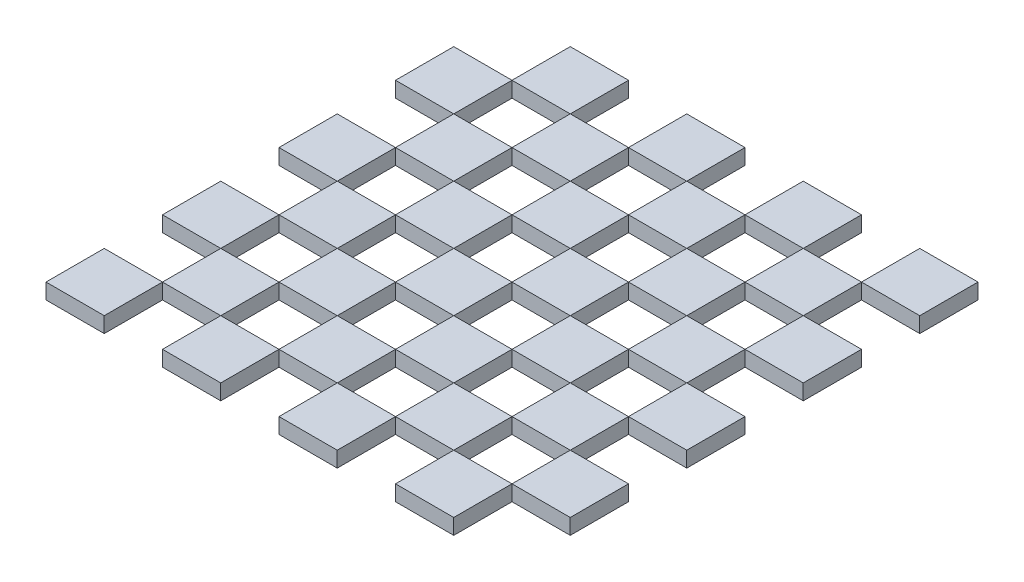
from build123d import *

# Parameters (mm, degrees)
SKETCH1_W              = 37.5
SKETCH1_H              = 37.5
BOSS_EXTRUDE1_DEPTH    = 10
BOSS_EXTRUDE1_2_DEPTH  = 10
BOSS_EXTRUDE1_3_DEPTH  = 10
BOSS_EXTRUDE1_4_DEPTH  = 10
BOSS_EXTRUDE1_5_DEPTH  = 10
BOSS_EXTRUDE1_6_DEPTH  = 10
BOSS_EXTRUDE1_7_DEPTH  = 10
BOSS_EXTRUDE1_8_DEPTH  = 10
BOSS_EXTRUDE1_9_DEPTH  = 10
BOSS_EXTRUDE1_10_DEPTH = 10
BOSS_EXTRUDE1_11_DEPTH = 10
BOSS_EXTRUDE1_12_DEPTH = 10
BOSS_EXTRUDE1_13_DEPTH = 10
BOSS_EXTRUDE1_14_DEPTH = 10
BOSS_EXTRUDE1_15_DEPTH = 10
BOSS_EXTRUDE1_16_DEPTH = 10
BOSS_EXTRUDE1_17_DEPTH = 10
BOSS_EXTRUDE1_18_DEPTH = 10
BOSS_EXTRUDE1_19_DEPTH = 10
BOSS_EXTRUDE1_20_DEPTH = 10
BOSS_EXTRUDE1_21_DEPTH = 10
BOSS_EXTRUDE1_22_DEPTH = 10
BOSS_EXTRUDE1_23_DEPTH = 10
BOSS_EXTRUDE1_24_DEPTH = 10
BOSS_EXTRUDE1_25_DEPTH = 10
BOSS_EXTRUDE1_26_DEPTH = 10
BOSS_EXTRUDE1_27_DEPTH = 10
BOSS_EXTRUDE1_28_DEPTH = 10
BOSS_EXTRUDE1_29_DEPTH = 10
BOSS_EXTRUDE1_30_DEPTH = 10
BOSS_EXTRUDE1_31_DEPTH = 10
BOSS_EXTRUDE1_32_DEPTH = 10


with BuildPart() as part:
    # Sketch1 → Boss-Extrude1 (new body)
    with BuildSketch(Plane(origin=(0, 0, 0), x_dir=(1, 0, 0), z_dir=(0, 1, 0))):
        with Locations((-131.25, -131.25)):
            Rectangle(SKETCH1_W, SKETCH1_H)
    extrude(amount=BOSS_EXTRUDE1_DEPTH)


with BuildPart() as body_2:
    # Sketch1 → Boss-Extrude1 2 (new body)
    with BuildSketch(Plane(origin=(0, 0, 0), x_dir=(1, 0, 0), z_dir=(0, 1, 0))):
        with Locations((-56.25, -131.25)):
            Rectangle(SKETCH1_W, SKETCH1_H)
    extrude(amount=BOSS_EXTRUDE1_2_DEPTH)


with BuildPart() as body_3:
    # Sketch1 → Boss-Extrude1 3 (new body)
    with BuildSketch(Plane(origin=(0, 0, 0), x_dir=(1, 0, 0), z_dir=(0, 1, 0))):
        with Locations((18.75, -131.25)):
            Rectangle(SKETCH1_W, SKETCH1_H)
    extrude(amount=BOSS_EXTRUDE1_3_DEPTH)


with BuildPart() as body_4:
    # Sketch1 → Boss-Extrude1 4 (new body)
    with BuildSketch(Plane(origin=(0, 0, 0), x_dir=(1, 0, 0), z_dir=(0, 1, 0))):
        with Locations((93.75, -131.25)):
            Rectangle(SKETCH1_W, SKETCH1_H)
    extrude(amount=BOSS_EXTRUDE1_4_DEPTH)


with BuildPart() as body_5:
    # Sketch1 → Boss-Extrude1 5 (new body)
    with BuildSketch(Plane(origin=(0, 0, 0), x_dir=(1, 0, 0), z_dir=(0, 1, 0))):
        with Locations((131.25, -93.75)):
            Rectangle(SKETCH1_W, SKETCH1_H)
    extrude(amount=BOSS_EXTRUDE1_5_DEPTH)


with BuildPart() as body_6:
    # Sketch1 → Boss-Extrude1 6 (new body)
    with BuildSketch(Plane(origin=(0, 0, 0), x_dir=(1, 0, 0), z_dir=(0, 1, 0))):
        with Locations((131.25, -18.75)):
            Rectangle(SKETCH1_W, SKETCH1_H)
    extrude(amount=BOSS_EXTRUDE1_6_DEPTH)


with BuildPart() as body_7:
    # Sketch1 → Boss-Extrude1 7 (new body)
    with BuildSketch(Plane(origin=(0, 0, 0), x_dir=(1, 0, 0), z_dir=(0, 1, 0))):
        with Locations((131.25, 56.25)):
            Rectangle(SKETCH1_W, SKETCH1_H)
    extrude(amount=BOSS_EXTRUDE1_7_DEPTH)


with BuildPart() as body_8:
    # Sketch1 → Boss-Extrude1 8 (new body)
    with BuildSketch(Plane(origin=(0, 0, 0), x_dir=(1, 0, 0), z_dir=(0, 1, 0))):
        with Locations((131.25, 131.25)):
            Rectangle(SKETCH1_W, SKETCH1_H)
    extrude(amount=BOSS_EXTRUDE1_8_DEPTH)


with BuildPart() as body_9:
    # Sketch1 → Boss-Extrude1 9 (new body)
    with BuildSketch(Plane(origin=(0, 0, 0), x_dir=(1, 0, 0), z_dir=(0, 1, 0))):
        with Locations((93.75, 93.75)):
            Rectangle(SKETCH1_W, SKETCH1_H)
    extrude(amount=BOSS_EXTRUDE1_9_DEPTH)


with BuildPart() as body_10:
    # Sketch1 → Boss-Extrude1 10 (new body)
    with BuildSketch(Plane(origin=(0, 0, 0), x_dir=(1, 0, 0), z_dir=(0, 1, 0))):
        with Locations((93.75, 18.75)):
            Rectangle(SKETCH1_W, SKETCH1_H)
    extrude(amount=BOSS_EXTRUDE1_10_DEPTH)


with BuildPart() as body_11:
    # Sketch1 → Boss-Extrude1 11 (new body)
    with BuildSketch(Plane(origin=(0, 0, 0), x_dir=(1, 0, 0), z_dir=(0, 1, 0))):
        with Locations((93.75, -56.25)):
            Rectangle(SKETCH1_W, SKETCH1_H)
    extrude(amount=BOSS_EXTRUDE1_11_DEPTH)


with BuildPart() as body_12:
    # Sketch1 → Boss-Extrude1 12 (new body)
    with BuildSketch(Plane(origin=(0, 0, 0), x_dir=(1, 0, 0), z_dir=(0, 1, 0))):
        with Locations((56.25, -93.75)):
            Rectangle(SKETCH1_W, SKETCH1_H)
    extrude(amount=BOSS_EXTRUDE1_12_DEPTH)


with BuildPart() as body_13:
    # Sketch1 → Boss-Extrude1 13 (new body)
    with BuildSketch(Plane(origin=(0, 0, 0), x_dir=(1, 0, 0), z_dir=(0, 1, 0))):
        with Locations((56.25, -18.75)):
            Rectangle(SKETCH1_W, SKETCH1_H)
    extrude(amount=BOSS_EXTRUDE1_13_DEPTH)


with BuildPart() as body_14:
    # Sketch1 → Boss-Extrude1 14 (new body)
    with BuildSketch(Plane(origin=(0, 0, 0), x_dir=(1, 0, 0), z_dir=(0, 1, 0))):
        with Locations((56.25, 56.25)):
            Rectangle(SKETCH1_W, SKETCH1_H)
    extrude(amount=BOSS_EXTRUDE1_14_DEPTH)


with BuildPart() as body_15:
    # Sketch1 → Boss-Extrude1 15 (new body)
    with BuildSketch(Plane(origin=(0, 0, 0), x_dir=(1, 0, 0), z_dir=(0, 1, 0))):
        with Locations((56.25, 131.25)):
            Rectangle(SKETCH1_W, SKETCH1_H)
    extrude(amount=BOSS_EXTRUDE1_15_DEPTH)


with BuildPart() as body_16:
    # Sketch1 → Boss-Extrude1 16 (new body)
    with BuildSketch(Plane(origin=(0, 0, 0), x_dir=(1, 0, 0), z_dir=(0, 1, 0))):
        with Locations((18.75, 93.75)):
            Rectangle(SKETCH1_W, SKETCH1_H)
    extrude(amount=BOSS_EXTRUDE1_16_DEPTH)


with BuildPart() as body_17:
    # Sketch1 → Boss-Extrude1 17 (new body)
    with BuildSketch(Plane(origin=(0, 0, 0), x_dir=(1, 0, 0), z_dir=(0, 1, 0))):
        with Locations((18.75, 18.75)):
            Rectangle(SKETCH1_W, SKETCH1_H)
    extrude(amount=BOSS_EXTRUDE1_17_DEPTH)


with BuildPart() as body_18:
    # Sketch1 → Boss-Extrude1 18 (new body)
    with BuildSketch(Plane(origin=(0, 0, 0), x_dir=(1, 0, 0), z_dir=(0, 1, 0))):
        with Locations((18.75, -56.25)):
            Rectangle(SKETCH1_W, SKETCH1_H)
    extrude(amount=BOSS_EXTRUDE1_18_DEPTH)


with BuildPart() as body_19:
    # Sketch1 → Boss-Extrude1 19 (new body)
    with BuildSketch(Plane(origin=(0, 0, 0), x_dir=(1, 0, 0), z_dir=(0, 1, 0))):
        with Locations((-18.75, -93.75)):
            Rectangle(SKETCH1_W, SKETCH1_H)
    extrude(amount=BOSS_EXTRUDE1_19_DEPTH)


with BuildPart() as body_20:
    # Sketch1 → Boss-Extrude1 20 (new body)
    with BuildSketch(Plane(origin=(0, 0, 0), x_dir=(1, 0, 0), z_dir=(0, 1, 0))):
        with Locations((-18.75, -18.75)):
            Rectangle(SKETCH1_W, SKETCH1_H)
    extrude(amount=BOSS_EXTRUDE1_20_DEPTH)


with BuildPart() as body_21:
    # Sketch1 → Boss-Extrude1 21 (new body)
    with BuildSketch(Plane(origin=(0, 0, 0), x_dir=(1, 0, 0), z_dir=(0, 1, 0))):
        with Locations((-18.75, 56.25)):
            Rectangle(SKETCH1_W, SKETCH1_H)
    extrude(amount=BOSS_EXTRUDE1_21_DEPTH)


with BuildPart() as body_22:
    # Sketch1 → Boss-Extrude1 22 (new body)
    with BuildSketch(Plane(origin=(0, 0, 0), x_dir=(1, 0, 0), z_dir=(0, 1, 0))):
        with Locations((-18.75, 131.25)):
            Rectangle(SKETCH1_W, SKETCH1_H)
    extrude(amount=BOSS_EXTRUDE1_22_DEPTH)


with BuildPart() as body_23:
    # Sketch1 → Boss-Extrude1 23 (new body)
    with BuildSketch(Plane(origin=(0, 0, 0), x_dir=(1, 0, 0), z_dir=(0, 1, 0))):
        with Locations((-93.75, 131.25)):
            Rectangle(SKETCH1_W, SKETCH1_H)
    extrude(amount=BOSS_EXTRUDE1_23_DEPTH)


with BuildPart() as body_24:
    # Sketch1 → Boss-Extrude1 24 (new body)
    with BuildSketch(Plane(origin=(0, 0, 0), x_dir=(1, 0, 0), z_dir=(0, 1, 0))):
        with Locations((-131.25, 93.75)):
            Rectangle(SKETCH1_W, SKETCH1_H)
    extrude(amount=BOSS_EXTRUDE1_24_DEPTH)


with BuildPart() as body_25:
    # Sketch1 → Boss-Extrude1 25 (new body)
    with BuildSketch(Plane(origin=(0, 0, 0), x_dir=(1, 0, 0), z_dir=(0, 1, 0))):
        with Locations((-56.25, 93.75)):
            Rectangle(SKETCH1_W, SKETCH1_H)
    extrude(amount=BOSS_EXTRUDE1_25_DEPTH)


with BuildPart() as body_26:
    # Sketch1 → Boss-Extrude1 26 (new body)
    with BuildSketch(Plane(origin=(0, 0, 0), x_dir=(1, 0, 0), z_dir=(0, 1, 0))):
        with Locations((-93.75, 56.25)):
            Rectangle(SKETCH1_W, SKETCH1_H)
    extrude(amount=BOSS_EXTRUDE1_26_DEPTH)


with BuildPart() as body_27:
    # Sketch1 → Boss-Extrude1 27 (new body)
    with BuildSketch(Plane(origin=(0, 0, 0), x_dir=(1, 0, 0), z_dir=(0, 1, 0))):
        with Locations((-56.25, 18.75)):
            Rectangle(SKETCH1_W, SKETCH1_H)
    extrude(amount=BOSS_EXTRUDE1_27_DEPTH)


with BuildPart() as body_28:
    # Sketch1 → Boss-Extrude1 28 (new body)
    with BuildSketch(Plane(origin=(0, 0, 0), x_dir=(1, 0, 0), z_dir=(0, 1, 0))):
        with Locations((-131.25, 18.75)):
            Rectangle(SKETCH1_W, SKETCH1_H)
    extrude(amount=BOSS_EXTRUDE1_28_DEPTH)


with BuildPart() as body_29:
    # Sketch1 → Boss-Extrude1 29 (new body)
    with BuildSketch(Plane(origin=(0, 0, 0), x_dir=(1, 0, 0), z_dir=(0, 1, 0))):
        with Locations((-93.75, -18.75)):
            Rectangle(SKETCH1_W, SKETCH1_H)
    extrude(amount=BOSS_EXTRUDE1_29_DEPTH)


with BuildPart() as body_30:
    # Sketch1 → Boss-Extrude1 30 (new body)
    with BuildSketch(Plane(origin=(0, 0, 0), x_dir=(1, 0, 0), z_dir=(0, 1, 0))):
        with Locations((-131.25, -56.25)):
            Rectangle(SKETCH1_W, SKETCH1_H)
    extrude(amount=BOSS_EXTRUDE1_30_DEPTH)


with BuildPart() as body_31:
    # Sketch1 → Boss-Extrude1 31 (new body)
    with BuildSketch(Plane(origin=(0, 0, 0), x_dir=(1, 0, 0), z_dir=(0, 1, 0))):
        with Locations((-56.25, -56.25)):
            Rectangle(SKETCH1_W, SKETCH1_H)
    extrude(amount=BOSS_EXTRUDE1_31_DEPTH)


with BuildPart() as body_32:
    # Sketch1 → Boss-Extrude1 32 (new body)
    with BuildSketch(Plane(origin=(0, 0, 0), x_dir=(1, 0, 0), z_dir=(0, 1, 0))):
        with Locations((-93.75, -93.75)):
            Rectangle(SKETCH1_W, SKETCH1_H)
    extrude(amount=BOSS_EXTRUDE1_32_DEPTH)


solid = Compound([part.part, body_2.part, body_3.part, body_4.part, body_5.part, body_6.part, body_7.part, body_8.part, body_9.part, body_10.part, body_11.part, body_12.part, body_13.part, body_14.part, body_15.part, body_16.part, body_17.part, body_18.part, body_19.part, body_20.part, body_21.part, body_22.part, body_23.part, body_24.part, body_25.part, body_26.part, body_27.part, body_28.part, body_29.part, body_30.part, body_31.part, body_32.part])
